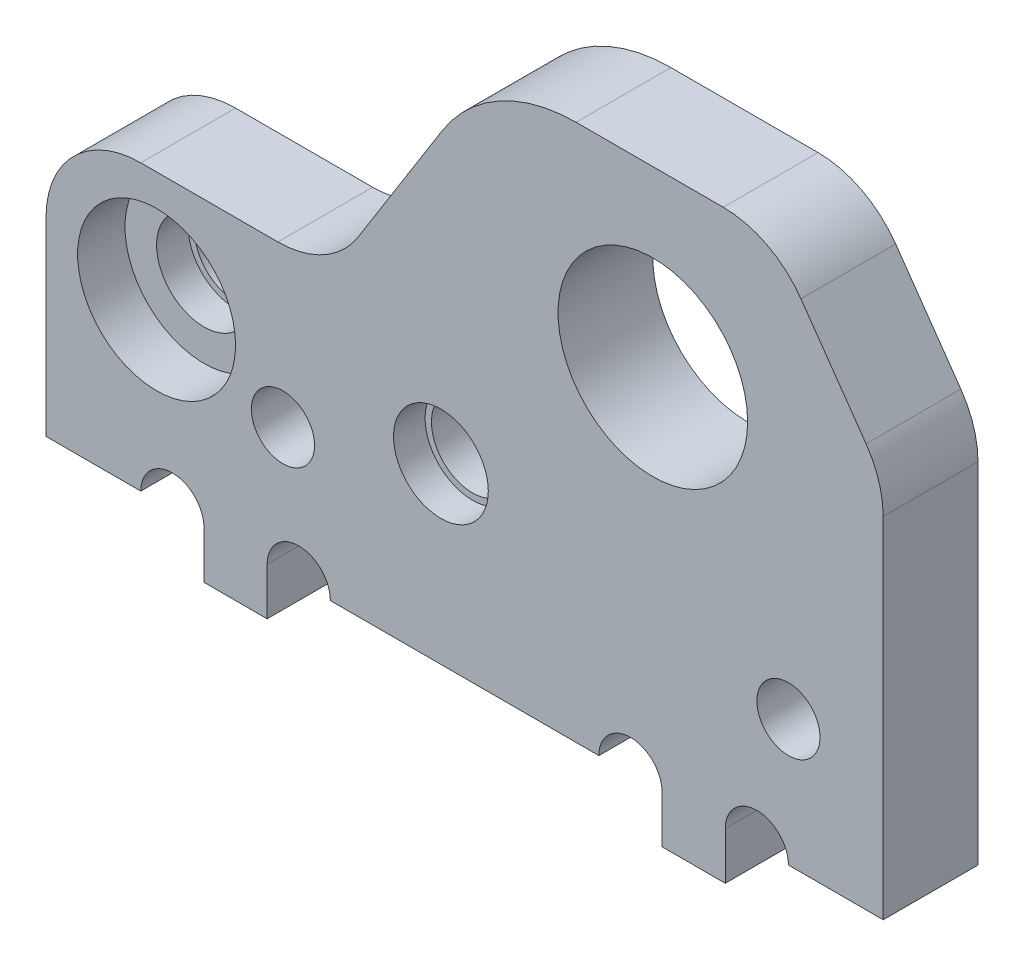
from build123d import *

# Parameters (mm, degrees)
SKETCH1_W                            = 26.5
SKETCH1_H                            = 6
BOSS_EXTRUDE1_DEPTH                  = 17
SKETCH2_R                            = 1.5
CUT_EXTRUDE1_DEPTH                   = 1
SKETCH3_R                            = 1.3
CUT_EXTRUDE2_DEPTH                   = 32.878676259
SKETCH4_R                            = 3
CUT_EXTRUDE3_DEPTH                   = 33.050741021
SKETCH5_R                            = 2.5
CUT_EXTRUDE4_DEPTH                   = 1.5
SKETCH6_R                            = 1.5
CUT_EXTRUDE8_DEPTH                   = 1
SKETCH7_R                            = 1.3
CUT_EXTRUDE9_DEPTH                   = 32.678068123
CUT_EXTRUDE10_START                  = -1
SKETCH8_R                            = 2.5
CUT_EXTRUDE10_DEPTH                  = 1
CUT_EXTRUDE11_START                  = -1
SKETCH9_R                            = 1.5
CUT_EXTRUDE11_DEPTH                  = 1
SKETCH10_R                           = 5.5
SKETCH10_R_2                         = 3
BOSS_EXTRUDE2_DEPTH                  = 3.5
SKETCH11_R                           = 3
SKETCH11_R_2                         = 1.3
BOSS_EXTRUDE4_DEPTH                  = 2
CUT_EXTRUDE12_START                  = -1
SKETCH12_R                           = 1.5
CUT_EXTRUDE12_DEPTH                  = 1
SKETCH17_W                           = 2
SKETCH17_H                           = 6
BOSS_EXTRUDE6_DEPTH                  = 1.5
SKETCH18_R                           = 1
CUT_EXTRUDE17_DEPTH                  = 33.050741021
CHAMFER2_SIZE                        = 5
CHAMFER2_SIZE2                       = 3.5
FILLET11_R                           = 3
BOSS_EXTRUDE7_DEPTH                  = 2
CUT_EXTRUDE19_DEPTH                  = 33.050741021
FILLET13_R                           = 5
FILLET14_R                           = 3
FILLET15_R                           = 3
SKIZZE1_R                            = 1
SCHNITT_LINEAR_AUSTRAGEN1_DEPTH      = 33.050741021
SCHNITT_LINEAR_AUSTRAGEN2_DEPTH      = 31.409702399
SCHNITT_LINEAR_AUSTRAGEN2_DEPTH_BACK = 31.409702399
SKIZZE2_W                            = 26.5
SKIZZE2_H                            = 6.5


with BuildPart() as part:
    # Sketch1 → Boss-Extrude1 (new body)
    with BuildSketch(Plane(origin=(0, 0, 0), x_dir=(1, 0, 0), z_dir=(0, 1, 0))):
        with Locations((13.25, 3)):
            Rectangle(SKETCH1_W, SKETCH1_H)
    extrude(amount=BOSS_EXTRUDE1_DEPTH)

    # Sketch2 → Cut-Extrude1 (cut)
    with BuildSketch(Plane.XY):
        with Locations((12.5, 5.5)):
            Circle(SKETCH2_R)
    extrude(amount=-CUT_EXTRUDE1_DEPTH, mode=Mode.SUBTRACT)

    # Sketch3 → Cut-Extrude2 (cut, through all)
    with BuildSketch(Plane.XY.offset(-1)):
        with Locations((12.5, 5.5)):
            Circle(SKETCH3_R)
    extrude(amount=-CUT_EXTRUDE2_DEPTH, mode=Mode.SUBTRACT)

    # Sketch4 → Cut-Extrude3 (cut, through all)
    with BuildSketch(Plane.XY):
        with Locations((19.208203932, 11.5)):
            Circle(SKETCH4_R)
    extrude(amount=-CUT_EXTRUDE3_DEPTH, mode=Mode.SUBTRACT)

    # Sketch5 → Cut-Extrude4 (cut)
    with BuildSketch(Plane.XY):
        with Locations((3.5, 5.5)):
            Circle(SKETCH5_R)
    extrude(amount=-CUT_EXTRUDE4_DEPTH, mode=Mode.SUBTRACT)

    # Sketch6 → Cut-Extrude8 (cut)
    with BuildSketch(Plane.XY.offset(-1.5)):
        with Locations((3.5, 5.5)):
            Circle(SKETCH6_R)
    extrude(amount=-CUT_EXTRUDE8_DEPTH, mode=Mode.SUBTRACT)

    # Sketch7 → Cut-Extrude9 (cut, through all)
    with BuildSketch(Plane.XY.offset(-2.5)):
        with Locations((3.5, 5.5)):
            Circle(SKETCH7_R)
    extrude(amount=-CUT_EXTRUDE9_DEPTH, mode=Mode.SUBTRACT)

    # Sketch8 → Cut-Extrude10 (cut)
    with BuildSketch(Plane(origin=(0, 0, -6), x_dir=(-1, 0, 0), z_dir=(0, 0, -1)).offset(CUT_EXTRUDE10_START)):
        with Locations(Location((-3.5, 5.5, 0), (0, 0, 180))):
            Circle(SKETCH8_R)
    extrude(amount=CUT_EXTRUDE10_DEPTH, mode=Mode.SUBTRACT)

    # Sketch9 → Cut-Extrude11 (cut)
    with BuildSketch(Plane(origin=(0, 0, -5), x_dir=(-1, 0, 0), z_dir=(0, 0, -1)).offset(CUT_EXTRUDE11_START)):
        with Locations(Location((-3.5, 5.5, 0), (0, 0, 180))):
            Circle(SKETCH9_R)
    extrude(amount=CUT_EXTRUDE11_DEPTH, mode=Mode.SUBTRACT)

    # Sketch10 → Boss-Extrude2 (add)
    with BuildSketch(Plane(origin=(0, 0, -6), x_dir=(-1, 0, 0), z_dir=(0, 0, -1))):
        with Locations(Location((-19.208203932, 11.5, 0), (0, 0, 90))):
            Circle(SKETCH10_R)
        with Locations(Location((-19.208203932, 11.5, 0), (0, 0, 180))):
            Circle(SKETCH10_R_2, mode=Mode.SUBTRACT)
    extrude(amount=BOSS_EXTRUDE2_DEPTH)

    # Sketch11 → Boss-Extrude4 (add)
    with BuildSketch(Plane(origin=(0, 0, -6), x_dir=(-1, 0, 0), z_dir=(0, 0, -1))):
        with Locations(Location((-12.5, 5.5, 0), (0, 0, 180))):
            Circle(SKETCH11_R)
        with Locations(Location((-12.5, 5.5, 0), (0, 0, 180))):
            Circle(SKETCH11_R_2, mode=Mode.SUBTRACT)
    extrude(amount=BOSS_EXTRUDE4_DEPTH)

    # Sketch12 → Cut-Extrude12 (cut)
    with BuildSketch(Plane(origin=(0, 0, -8), x_dir=(-1, 0, 0), z_dir=(0, 0, -1)).offset(CUT_EXTRUDE12_START)):
        with Locations(Location((-12.5, 5.5, 0), (0, 0, 180))):
            Circle(SKETCH12_R)
    extrude(amount=CUT_EXTRUDE12_DEPTH, mode=Mode.SUBTRACT)

    # Sketch17 → Boss-Extrude6 (add)
    with BuildSketch(Plane.XZ):
        with Locations((6, -3)):
            Rectangle(SKETCH17_W, SKETCH17_H)
        with Locations((20.5, -3)):
            Rectangle(SKETCH17_W, SKETCH17_H)
    extrude(amount=BOSS_EXTRUDE6_DEPTH)

    # Sketch18 → Cut-Extrude17 (cut, through all)
    with BuildSketch(Plane(origin=(0, 0, -6), x_dir=(-1, 0, 0), z_dir=(0, 0, -1))):
        with Locations((-22.5, 0)):
            Circle(SKETCH18_R)
        with Locations((-18.5, 0)):
            Circle(SKETCH18_R)
        with Locations((-8, 0)):
            Circle(SKETCH18_R)
        with Locations((-4, 0)):
            Circle(SKETCH18_R)
    extrude(amount=-CUT_EXTRUDE17_DEPTH, mode=Mode.SUBTRACT)

    # Chamfer2
    chamfer2_edges = [part.edges().sort_by_distance(p)[0] for p in [
        (26.5, 17, -3),
    ]]
    chamfer2_side = [part.faces().sort_by_distance(p)[0] for p in [
        (26.5, 8.5, -3),
    ]]
    chamfer(chamfer2_edges, length=CHAMFER2_SIZE, length2=CHAMFER2_SIZE2, reference=chamfer2_side[0])

    # Fillet11
    fillet11_edges = [part.edges().sort_by_distance(p)[0] for p in [
        (23, 17, -3),
        (26.5, 12, -3),
    ]]
    fillet(fillet11_edges, radius=FILLET11_R)

    # Sketch19 → Boss-Extrude7 (add)
    with BuildSketch(Plane(origin=(0, 0, -6), x_dir=(-1, 0, 0), z_dir=(0, 0, -1))):
        with BuildLine():
            Line((-14.547099294, 14.419606745), (-9.957579288, 7.09251277))
            ThreePointArc((-9.957579288, 7.09251277), (-14.736067977, 7.5), (-13.800160725, 2.796376119))
            Line((-13.800160725, 2.796376119), (-21.591831928, 6.543356218))
            ThreePointArc((-21.591831928, 6.543356218), (-15.108745974, 7.833333333), (-14.547099294, 14.419606745))
        make_face()
    extrude(amount=BOSS_EXTRUDE7_DEPTH)

    # Sketch20 → Cut-Extrude19 (cut, through all)
    with BuildSketch(Plane(origin=(0, 0, -6), x_dir=(-1, 0, 0), z_dir=(0, 0, -1))):
        Polygon((0, 17), (-14.011012575, 17), (-9, 9), (0, 9), align=None)
    extrude(amount=-CUT_EXTRUDE19_DEPTH, mode=Mode.SUBTRACT)

    # Fillet13
    fillet13_edges = [part.edges().sort_by_distance(p)[0] for p in [
        (14.011012575, 17, -3),
    ]]
    fillet(fillet13_edges, radius=FILLET13_R)

    # Fillet14
    fillet14_edges = [part.edges().sort_by_distance(p)[0] for p in [
        (9, 9, -3),
    ]]
    fillet(fillet14_edges, radius=FILLET14_R)

    # Fillet15
    fillet15_edges = [part.edges().sort_by_distance(p)[0] for p in [
        (0, 9, -3),
    ]]
    fillet(fillet15_edges, radius=FILLET15_R)

    # Skizze1 → Schnitt-Linear austragen1 (cut, through all)
    with BuildSketch(Plane(origin=(0, 0, -6), x_dir=(-1, 0, 0), z_dir=(0, 0, -1))):
        with Locations((-23.5, 4)):
            Circle(SKIZZE1_R)
        with Locations((-7.5, 4)):
            Circle(SKIZZE1_R)
    extrude(amount=-SCHNITT_LINEAR_AUSTRAGEN1_DEPTH, mode=Mode.SUBTRACT)

    # Skizze2 → Schnitt-Linear austragen2 (cut, two sides: drawn at the far end of the back side and taken through both)
    with BuildSketch(Plane(origin=(0, 5.5, 0), x_dir=(1, 0, 0), z_dir=(0, 1, 0)).offset(-SCHNITT_LINEAR_AUSTRAGEN2_DEPTH_BACK)):
        with Locations((13.25, 6.25)):
            Rectangle(SKIZZE2_W, SKIZZE2_H)
    extrude(amount=SCHNITT_LINEAR_AUSTRAGEN2_DEPTH + SCHNITT_LINEAR_AUSTRAGEN2_DEPTH_BACK, mode=Mode.SUBTRACT)


solid = part.part
